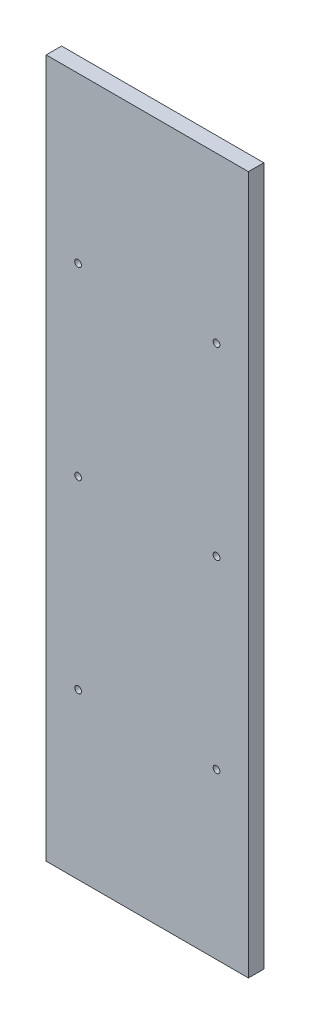
from build123d import *

# Parameters (mm, degrees)
SKETCH1_W           = 83.5
SKETCH1_H           = 288.29
SKETCH1_R           = 1.3890625
BOSS_EXTRUDE1_DEPTH = 6.35


with BuildPart() as part:
    # Sketch1 → Boss-Extrude1 (new body)
    with BuildSketch(Plane.XY):
        with Locations((41.75, -144.145)):
            Rectangle(SKETCH1_W, SKETCH1_H)
        with Locations((13.175, -220.345)):
            Circle(SKETCH1_R, mode=Mode.SUBTRACT)
        with Locations((70.325, -220.345)):
            Circle(SKETCH1_R, mode=Mode.SUBTRACT)
        with Locations((70.325, -144.145)):
            Circle(SKETCH1_R, mode=Mode.SUBTRACT)
        with Locations((13.175, -67.945)):
            Circle(SKETCH1_R, mode=Mode.SUBTRACT)
        with Locations((70.325, -67.945)):
            Circle(SKETCH1_R, mode=Mode.SUBTRACT)
        with Locations((13.175, -144.145)):
            Circle(SKETCH1_R, mode=Mode.SUBTRACT)
    extrude(amount=BOSS_EXTRUDE1_DEPTH)


solid = part.part
